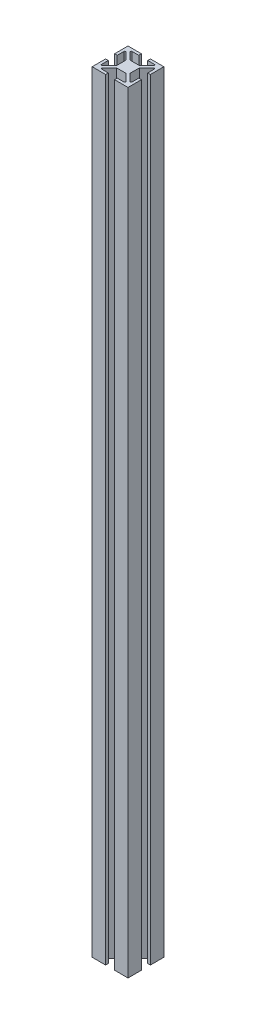
from build123d import *

# Parameters (mm, degrees)
BOSS_EXTRU_1_DEPTH = 430


with BuildPart() as part:
    # Esquisse1 → Boss.-Extru.1 (new body)
    with BuildSketch(Plane(origin=(0, 0, 0), x_dir=(1, 0, 0), z_dir=(0, 1, 0))):
        with BuildLine():
            Line((-10, -2.5), (-10, -10))
            Line((-10, -10), (-2.5, -10))
            Line((-2.5, -10), (-2.5, -8.5))
            Line((-2.5, -8.5), (-6.232233047, -8.5))
            ThreePointArc((-6.232233047, -8.5), (-6.694172813, -8.191341716), (-6.585786438, -7.646446609))
            Line((-6.585786438, -7.646446609), (-2.689339828, -3.75))
            Line((-2.689339828, -3.75), (2.689339828, -3.75))
            Line((2.689339828, -3.75), (6.585786438, -7.646446609))
            ThreePointArc((6.585786438, -7.646446609), (6.694172813, -8.191341716), (6.232233047, -8.5))
            Line((6.232233047, -8.5), (2.5, -8.5))
            Line((2.5, -8.5), (2.5, -10))
            Line((2.5, -10), (10, -10))
            Line((10, -10), (10, -2.5))
            Line((10, -2.5), (8.5, -2.5))
            Line((8.5, -2.5), (8.5, -6.232233047))
            ThreePointArc((8.5, -6.232233047), (8.191341716, -6.694172813), (7.646446609, -6.585786438))
            Line((7.646446609, -6.585786438), (3.75, -2.689339828))
            Line((3.75, -2.689339828), (3.75, 2.689339828))
            Line((3.75, 2.689339828), (7.646446609, 6.585786438))
            ThreePointArc((7.646446609, 6.585786438), (8.191341716, 6.694172813), (8.5, 6.232233047))
            Line((8.5, 6.232233047), (8.5, 2.5))
            Line((8.5, 2.5), (10, 2.5))
            Line((10, 2.5), (10, 10))
            Line((10, 10), (2.5, 10))
            Line((2.5, 10), (2.5, 8.5))
            Line((2.5, 8.5), (6.232233047, 8.5))
            ThreePointArc((6.232233047, 8.5), (6.694172813, 8.191341716), (6.585786438, 7.646446609))
            Line((6.585786438, 7.646446609), (2.689339828, 3.75))
            Line((2.689339828, 3.75), (-2.689339828, 3.75))
            Line((-2.689339828, 3.75), (-6.585786438, 7.646446609))
            ThreePointArc((-6.585786438, 7.646446609), (-6.694172813, 8.191341716), (-6.232233047, 8.5))
            Line((-6.232233047, 8.5), (-2.5, 8.5))
            Line((-2.5, 8.5), (-2.5, 10))
            Line((-2.5, 10), (-10, 10))
            Line((-10, 10), (-10, 2.5))
            Line((-10, 2.5), (-8.5, 2.5))
            Line((-8.5, 2.5), (-8.5, 6.232233047))
            ThreePointArc((-8.5, 6.232233047), (-8.191341716, 6.694172813), (-7.646446609, 6.585786438))
            Line((-7.646446609, 6.585786438), (-3.75, 2.689339828))
            Line((-3.75, 2.689339828), (-3.75, -2.689339828))
            Line((-3.75, -2.689339828), (-7.646446609, -6.585786438))
            ThreePointArc((-7.646446609, -6.585786438), (-8.191341716, -6.694172813), (-8.5, -6.232233047))
            Line((-8.5, -6.232233047), (-8.5, -2.5))
            Line((-8.5, -2.5), (-10, -2.5))
        make_face()
    extrude(amount=BOSS_EXTRU_1_DEPTH)


solid = part.part
